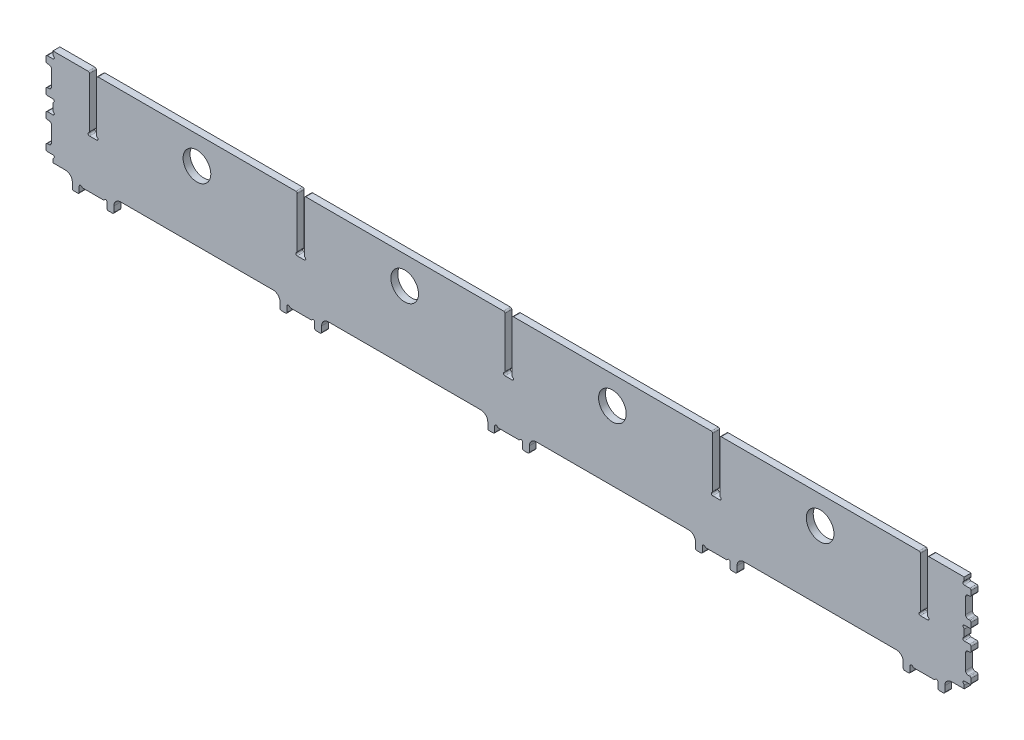
from build123d import *

# Parameters (mm, degrees)
SKETCH1_W               = 658
SKETCH1_H               = 80
BOSS_EXTRUDE1_DEPTH     = 2.5
CUT_EXTRUDE1_DEPTH      = 2.5
SKETCH3_W               = 20
SKETCH3_H               = 10
CUT_EXTRUDE2_DEPTH      = 2.5
SKETCH4_W               = 5.2
SKETCH4_H               = 40
CUT_EXTRUDE3_DEPTH      = 5
LPATTERN1_COUNT         = 3
LPATTERN1_PITCH         = 150
MIRROR3_COPY_1_SKETCH_W = 5.2
MIRROR3_COPY_1_SKETCH_H = 40
MIRROR3_COPY_1_DEPTH    = 5
MIRROR3_COPY_2_SKETCH_W = 5.2
MIRROR3_COPY_2_SKETCH_H = 40
MIRROR3_COPY_2_DEPTH    = 5
MIRROR3_COPY_3_SKETCH_W = 5.2
MIRROR3_COPY_3_SKETCH_H = 40
MIRROR3_COPY_3_DEPTH    = 5
SKETCH5_W               = 5
SKETCH5_H               = 25
BOSS_EXTRUDE2_DEPTH     = 5
SKETCH6_W               = 5
SKETCH6_H               = 15
CUT_EXTRUDE4_DEPTH      = 4
FILLET1_R               = 2
SKETCH7_R               = 1
CUT_EXTRUDE5_DEPTH      = 344.483624064
FILLET2_R               = 1
SKETCH8_R               = 1
CUT_EXTRUDE6_DEPTH      = 344.483624064
FILLET3_R               = 1
SKETCH9_R               = 1
CUT_EXTRUDE7_DEPTH      = 344.483624064
FILLET4_R               = 1
SKETCH10_R              = 10
CUT_EXTRUDE8_DEPTH      = 344.483624064


with BuildPart() as part:
    # Sketch1 → Boss-Extrude1 (new, symmetric)
    with BuildSketch(Plane.XY):
        with Locations((0, 40)):
            Rectangle(SKETCH1_W, SKETCH1_H)
    extrude(amount=BOSS_EXTRUDE1_DEPTH, both=True)

    # Sketch2 → Cut-Extrude1 (cut, symmetric)
    with BuildSketch(Plane.XY):
        with BuildLine():
            Line((-15, 0), (-135, 0))
            Line((-135, 0), (-135, 5))
            ThreePointArc((-135, 5), (-133.535533906, 8.535533906), (-130, 10))
            Line((-130, 10), (-20, 10))
            ThreePointArc((-20, 10), (-16.464466094, 8.535533906), (-15, 5))
            Line((-15, 5), (-15, 0))
        make_face()
        with BuildLine():
            Line((-165, 0), (-285, 0))
            Line((-285, 0), (-285, 5))
            ThreePointArc((-285, 5), (-283.535533906, 8.535533906), (-280, 10))
            Line((-280, 10), (-170, 10))
            ThreePointArc((-170, 10), (-166.464466094, 8.535533906), (-165, 5))
            Line((-165, 5), (-165, 0))
        make_face()
        with BuildLine():
            Line((-315, 0), (-329, 0))
            Line((-329, 0), (-329, 10))
            Line((-329, 10), (-320, 10))
            ThreePointArc((-320, 10), (-316.464466094, 8.535533906), (-315, 5))
            Line((-315, 5), (-315, 0))
        make_face()
    cut_extrude1 = extrude(amount=CUT_EXTRUDE1_DEPTH, both=True, mode=Mode.SUBTRACT)

    # Mirror1: Cut-Extrude1 across plane
    add(cut_extrude1.mirror(Plane(origin=(0, 0, 0), x_dir=(0, 0, 1), z_dir=(1, 0, 0))), mode=Mode.SUBTRACT)

    # Sketch3 → Cut-Extrude2 (cut, symmetric)
    with BuildSketch(Plane.XY):
        with Locations((150, 0)):
            Rectangle(SKETCH3_W, SKETCH3_H)
        Rectangle(SKETCH3_W, SKETCH3_H)
        with Locations((300, 0)):
            Rectangle(SKETCH3_W, SKETCH3_H)
    cut_extrude2 = extrude(amount=CUT_EXTRUDE2_DEPTH, both=True, mode=Mode.SUBTRACT)

    # Mirror2: Cut-Extrude2 across plane
    add(cut_extrude2.mirror(Plane(origin=(0, 0, 0), x_dir=(0, 0, 1), z_dir=(1, 0, 0))), mode=Mode.SUBTRACT)

    # Sketch4 → Cut-Extrude3 (cut, symmetric)
    with BuildSketch(Plane.XY):
        with Locations((0, 60)):
            Rectangle(SKETCH4_W, SKETCH4_H)
    cut_extrude3 = extrude(amount=CUT_EXTRUDE3_DEPTH, both=True, mode=Mode.SUBTRACT)

    # LPattern1: Cut-Extrude3 ×3
    with Locations(*[(i * LPATTERN1_PITCH, 0, 0) for i in range(1, LPATTERN1_COUNT)]):
        add(cut_extrude3, mode=Mode.SUBTRACT)

    # Mirror3 copy 1 sketch → Mirror3 copy 1 (cut, symmetric)
    with BuildSketch(Plane(origin=(-150, 0, 0), x_dir=(-1, 0, 0), z_dir=(0, 0, 1))):
        with Locations((0, -60)):
            Rectangle(MIRROR3_COPY_1_SKETCH_W, MIRROR3_COPY_1_SKETCH_H)
    extrude(amount=MIRROR3_COPY_1_DEPTH, both=True, mode=Mode.SUBTRACT)

    # Mirror3 copy 2 sketch → Mirror3 copy 2 (cut, symmetric)
    with BuildSketch(Plane(origin=(-300, 0, 0), x_dir=(-1, 0, 0), z_dir=(0, 0, 1))):
        with Locations((0, -60)):
            Rectangle(MIRROR3_COPY_2_SKETCH_W, MIRROR3_COPY_2_SKETCH_H)
    extrude(amount=MIRROR3_COPY_2_DEPTH, both=True, mode=Mode.SUBTRACT)

    # Mirror3 copy 3 sketch → Mirror3 copy 3 (cut, symmetric)
    with BuildSketch(Plane(origin=(0, 0, 0), x_dir=(-1, 0, 0), z_dir=(0, 0, 1))):
        with Locations((0, -60)):
            Rectangle(MIRROR3_COPY_3_SKETCH_W, MIRROR3_COPY_3_SKETCH_H)
    extrude(amount=MIRROR3_COPY_3_DEPTH, both=True, mode=Mode.SUBTRACT)

    # Sketch5 → Boss-Extrude2 (add)
    with BuildSketch(Plane(origin=(329, 0, 0), x_dir=(0, 0, -1), z_dir=(1, 0, 0))):
        with Locations((0, 62.5)):
            Rectangle(SKETCH5_W, SKETCH5_H)
        with Locations((0, 27.5)):
            Rectangle(SKETCH5_W, SKETCH5_H)
    boss_extrude2 = extrude(amount=BOSS_EXTRUDE2_DEPTH)

    # Sketch6 → Cut-Extrude4 (cut)
    with BuildSketch(Plane(origin=(334, 0, 0), x_dir=(0, 0, -1), z_dir=(1, 0, 0))):
        with Locations((0, 62.5)):
            Rectangle(SKETCH6_W, SKETCH6_H)
        with Locations((0, 27.5)):
            Rectangle(SKETCH6_W, SKETCH6_H)
    cut_extrude4 = extrude(amount=-CUT_EXTRUDE4_DEPTH, mode=Mode.SUBTRACT)

    # Mirror4: Boss-Extrude2, Cut-Extrude4 across plane
    add(boss_extrude2.mirror(Plane(origin=(0, 0, 0), x_dir=(0, 0, 1), z_dir=(1, 0, 0))))
    add(cut_extrude4.mirror(Plane(origin=(0, 0, 0), x_dir=(0, 0, 1), z_dir=(1, 0, 0))), mode=Mode.SUBTRACT)

    # Fillet1
    fillet1_edges = [part.edges().sort_by_distance(p)[0] for p in [
        (330, 70, 0),
        (330, 55, 0),
        (330, 35, 0),
        (330, 20, 0),
        (-330, 55, 0),
        (-330, 70, 0),
        (-330, 20, 0),
        (-330, 35, 0),
    ]]
    fillet(fillet1_edges, radius=FILLET1_R)

    # Sketch7 → Cut-Extrude5 (cut, through all)
    with BuildSketch(Plane(origin=(0, 0, -2.5), x_dir=(-1, 0, 0), z_dir=(0, 0, -1))):
        with Locations((-329, 76)):
            Circle(SKETCH7_R)
        with Locations((-329, 49)):
            Circle(SKETCH7_R)
        with Locations((-329, 41)):
            Circle(SKETCH7_R)
        with Locations((-329, 14)):
            Circle(SKETCH7_R)
        with Locations((329, 14)):
            Circle(SKETCH7_R)
        with Locations((329, 41)):
            Circle(SKETCH7_R)
        with Locations((329, 49)):
            Circle(SKETCH7_R)
        with Locations((329, 76)):
            Circle(SKETCH7_R)
    extrude(amount=-CUT_EXTRUDE5_DEPTH, mode=Mode.SUBTRACT)

    # Fillet2
    fillet2_edges = [part.edges().sort_by_distance(p)[0] for p in [
        (334, 50, 0),
        (334, 75, 0),
        (334, 40, 0),
        (334, 15, 0),
        (334, 55, 0),
        (334, 70, 0),
        (334, 20, 0),
        (334, 35, 0),
        (-334, 75, 0),
        (-334, 50, 0),
        (-334, 15, 0),
        (-334, 40, 0),
        (-334, 55, 0),
        (-334, 70, 0),
        (-334, 20, 0),
        (-334, 35, 0),
        (329, 48, 0),
        (329, 42, 0),
        (329, 13, 0),
        (-329, 13, 0),
        (-329, 42, 0),
        (-329, 48, 0),
        (-329, 77, 0),
        (329, 77, 0),
    ]]
    fillet(fillet2_edges, radius=FILLET2_R)

    # Sketch8 → Cut-Extrude6 (cut, through all)
    with BuildSketch(Plane(origin=(0, 0, -2.5), x_dir=(-1, 0, 0), z_dir=(0, 0, -1))):
        with Locations((-302.6, 41)):
            Circle(SKETCH8_R)
        with Locations((-297.4, 41)):
            Circle(SKETCH8_R)
        with Locations((-152.6, 41)):
            Circle(SKETCH8_R)
        with Locations((-147.4, 41)):
            Circle(SKETCH8_R)
        with Locations((-2.6, 41)):
            Circle(SKETCH8_R)
        with Locations((2.6, 41)):
            Circle(SKETCH8_R)
        with Locations((147.4, 41)):
            Circle(SKETCH8_R)
        with Locations((152.6, 41)):
            Circle(SKETCH8_R)
        with Locations((297.4, 41)):
            Circle(SKETCH8_R)
        with Locations((302.6, 41)):
            Circle(SKETCH8_R)
    extrude(amount=-CUT_EXTRUDE6_DEPTH, mode=Mode.SUBTRACT)

    # Fillet3
    fillet3_edges = [part.edges().sort_by_distance(p)[0] for p in [
        (2.6, 80, 0),
        (-2.6, 80, 0),
        (302.6, 80, 0),
        (297.4, 80, 0),
        (152.6, 80, 0),
        (147.4, 80, 0),
        (-147.4, 80, 0),
        (-152.6, 80, 0),
        (-297.4, 80, 0),
        (-302.6, 80, 0),
        (-152.6, 42, 0),
        (-302.6, 42, 0),
        (152.6, 42, 0),
        (147.4, 42, 0),
        (302.6, 42, 0),
        (297.4, 42, 0),
        (2.6, 42, 0),
        (-2.6, 42, 0),
        (-147.4, 42, 0),
        (-297.4, 42, 0),
    ]]
    fillet(fillet3_edges, radius=FILLET3_R)

    # Sketch9 → Cut-Extrude7 (cut, through all)
    with BuildSketch(Plane(origin=(0, 0, -2.5), x_dir=(-1, 0, 0), z_dir=(0, 0, -1))):
        with Locations((-309, 5)):
            Circle(SKETCH9_R)
        with Locations((-291, 5)):
            Circle(SKETCH9_R)
        with Locations((-159, 5)):
            Circle(SKETCH9_R)
        with Locations((-141, 5)):
            Circle(SKETCH9_R)
        with Locations((-9, 5)):
            Circle(SKETCH9_R)
        with Locations((9, 5)):
            Circle(SKETCH9_R)
        with Locations((141, 5)):
            Circle(SKETCH9_R)
        with Locations((159, 5)):
            Circle(SKETCH9_R)
        with Locations((291, 5)):
            Circle(SKETCH9_R)
        with Locations((309, 5)):
            Circle(SKETCH9_R)
    extrude(amount=-CUT_EXTRUDE7_DEPTH, mode=Mode.SUBTRACT)

    # Fillet4
    fillet4_edges = [part.edges().sort_by_distance(p)[0] for p in [
        (285, 0, 0),
        (-158, 5, 0),
        (-142, 5, 0),
        (315, 0, 0),
        (-308, 5, 0),
        (-292, 5, 0),
        (-8, 5, 0),
        (8, 5, 0),
        (142, 5, 0),
        (158, 5, 0),
        (292, 5, 0),
        (308, 5, 0),
        (10, 0, 0),
        (-10, 0, 0),
        (160, 0, 0),
        (140, 0, 0),
        (310, 0, 0),
        (290, 0, 0),
        (-160, 0, 0),
        (-140, 0, 0),
        (-310, 0, 0),
        (-290, 0, 0),
        (-15, 0, 0),
        (-135, 0, 0),
        (-165, 0, 0),
        (-285, 0, 0),
        (-315, 0, 0),
        (15, 0, 0),
        (135, 0, 0),
        (165, 0, 0),
    ]]
    fillet(fillet4_edges, radius=FILLET4_R)

    # Sketch10 → Cut-Extrude8 (cut, through all)
    with BuildSketch(Plane(origin=(0, 0, -2.5), x_dir=(-1, 0, 0), z_dir=(0, 0, -1))):
        with Locations((-75, 60)):
            Circle(SKETCH10_R)
        with Locations((-225, 60)):
            Circle(SKETCH10_R)
        with Locations(Location((225, 60, 0), (0, 0, 180))):
            Circle(SKETCH10_R)
        with Locations(Location((75, 60, 0), (0, 0, 180))):
            Circle(SKETCH10_R)
    extrude(amount=-CUT_EXTRUDE8_DEPTH, mode=Mode.SUBTRACT)


solid = part.part
